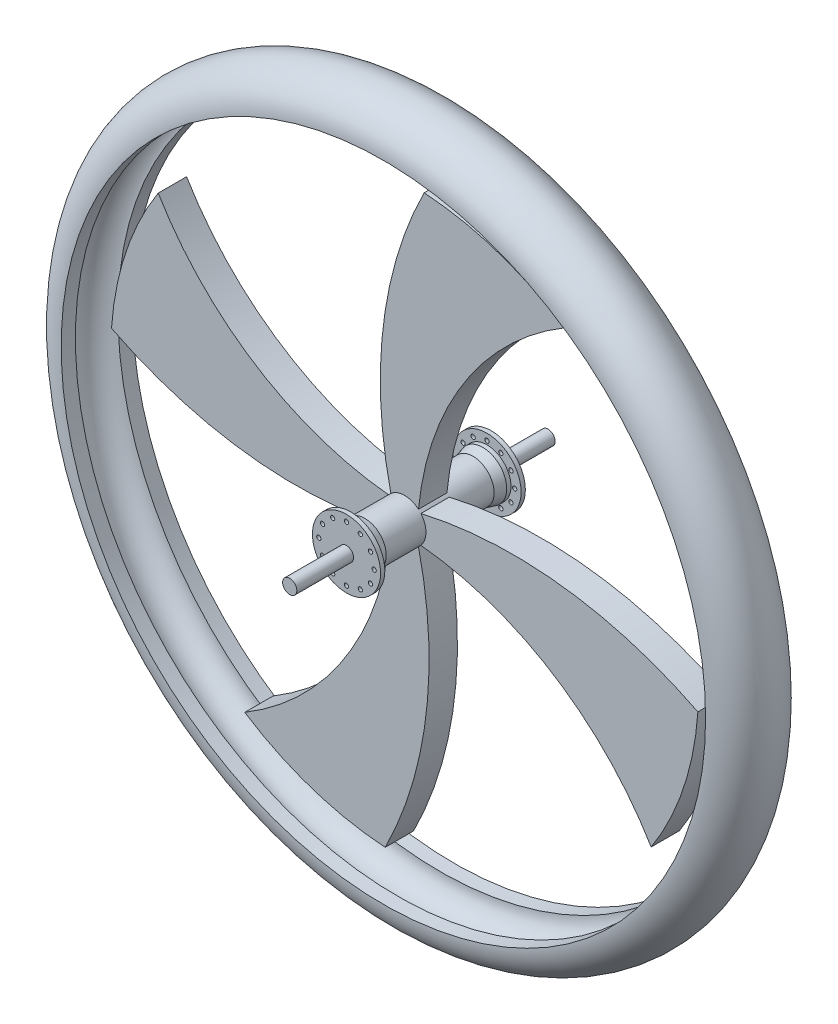
from build123d import *

# Parameters (mm, degrees)
SKETCH1_R           = 15
BOSS_EXTRUDE1_DEPTH = 38
SKETCH2_R           = 15
BOSS_EXTRUDE2_DEPTH = 7
BOSS_EXTRUDE2_DRAFT = -15
SKETCH3_R           = 16.875644347
BOSS_EXTRUDE3_DEPTH = 3
SKETCH4_R           = 24
BOSS_EXTRUDE4_DEPTH = 3
SKETCH5_R           = 1.5
CUT_EXTRUDE3_DEPTH  = 3
CIRPATTERN2_COUNT   = 12
SKETCH6_R           = 5
BOSS_EXTRUDE5_DEPTH = 40
BOSS_EXTRUDE7_DEPTH = 10


with BuildPart() as part:
    # Sketch1 → Boss-Extrude1 (new body)
    with BuildSketch(Plane.XY):
        Circle(SKETCH1_R)
    extrude(amount=BOSS_EXTRUDE1_DEPTH)


with BuildPart() as boss_extrude2_tool:
    # Sketch2 → Boss-Extrude2 (with draft: the straight prism first)
    with BuildSketch(Plane.XY.offset(38)):
        Circle(SKETCH2_R)
    extrude(amount=BOSS_EXTRUDE2_DEPTH)
    # Boss-Extrude2: the draft: its side faces are tilted about the plane it starts from
    boss_extrude2_sides = [boss_extrude2_tool.faces().sort_by_distance(p)[0] for p in [
        (-15, 0, 41.5),
    ]]
    draft(boss_extrude2_sides, Plane.XY.offset(38), BOSS_EXTRUDE2_DRAFT)


with BuildPart() as part_1:
    add(part.part)

    # Boss-Extrude2: add boss_extrude2_tool
    add(boss_extrude2_tool.part)

    # Sketch3 → Boss-Extrude3 (add)
    with BuildSketch(Plane.XY.offset(45)):
        Circle(SKETCH3_R)
    extrude(amount=BOSS_EXTRUDE3_DEPTH)

    # Sketch4 → Boss-Extrude4 (add)
    with BuildSketch(Plane.XY.offset(48)):
        Circle(SKETCH4_R)
    extrude(amount=BOSS_EXTRUDE4_DEPTH)

    # Sketch5 → Cut-Extrude3 (cut)
    with BuildSketch(Plane.XY.offset(51)):
        with Locations((0, 19.5)):
            Circle(SKETCH5_R)
    cut_extrude3 = extrude(amount=-CUT_EXTRUDE3_DEPTH, mode=Mode.SUBTRACT)

    # CirPattern2: Cut-Extrude3 ×12 about axis
    cirpattern2_axis = Axis((0, 0, 0), (0, 0, 1))
    for i in range(1, CIRPATTERN2_COUNT):
        add(cut_extrude3.rotate(cirpattern2_axis, i * 360 / CIRPATTERN2_COUNT), mode=Mode.SUBTRACT)

    # Mirror1: part across plane


with BuildPart() as part_2:
    add(part_1.part)
    add(part_1.part.mirror(Plane.XY))

    # Sketch6 → Boss-Extrude5 (add)
    with BuildSketch(Plane.XY.offset(51)):
        Circle(SKETCH6_R)
    extrude(amount=BOSS_EXTRUDE5_DEPTH)

    # Mirror2: part across plane


with BuildPart() as part_3:
    add(part_2.part)
    add(part_2.part.mirror(Plane.XY))

    # Sketch8 → Boss-Extrude7 (add, symmetric)
    with BuildSketch(Plane.XY):
        with BuildLine():
            ThreePointArc((13.734754013, 206.543836829), (65.30782189, 196.427819822), (112.671043027, 173.649751118))
            ThreePointArc((112.671043027, 173.649751118), (41.888763685, 104.790653332), (9.716380918, 11.427683136))
            ThreePointArc((9.716380918, 11.427683136), (0, 15), (-9.716380918, 11.427683136))
            ThreePointArc((-9.716380918, 11.427683136), (-15.120962757, 111.044643551), (13.734754013, 206.543836829))
        make_face()
        with BuildLine():
            ThreePointArc((11.427683136, 9.716380918), (111.044643551, 15.120962757), (206.543836829, -13.734754013))
            ThreePointArc((206.543836829, -13.734754013), (196.427819822, -65.30782189), (173.649751118, -112.671043027))
            ThreePointArc((173.649751118, -112.671043027), (104.790653332, -41.888763685), (11.427683136, -9.716380918))
            ThreePointArc((11.427683136, -9.716380918), (15, 0), (11.427683136, 9.716380918))
        make_face()
        with BuildLine():
            ThreePointArc((9.716380918, -11.427683136), (15.120962757, -111.044643551), (-13.734754013, -206.543836829))
            ThreePointArc((-13.734754013, -206.543836829), (-65.30782189, -196.427819822), (-112.671043027, -173.649751118))
            ThreePointArc((-112.671043027, -173.649751118), (-41.888763685, -104.790653332), (-9.716380918, -11.427683136))
            ThreePointArc((-9.716380918, -11.427683136), (0, -15), (9.716380918, -11.427683136))
        make_face()
        with BuildLine():
            ThreePointArc((-11.427683136, -9.716380918), (-111.044643551, -15.120962757), (-206.543836829, 13.734754013))
            ThreePointArc((-206.543836829, 13.734754013), (-196.427819822, 65.30782189), (-173.649751118, 112.671043027))
            ThreePointArc((-173.649751118, 112.671043027), (-104.790653332, 41.888763685), (-11.427683136, 9.716380918))
            ThreePointArc((-11.427683136, 9.716380918), (-15, 0), (-11.427683136, -9.716380918))
        make_face()
    extrude(amount=BOSS_EXTRUDE7_DEPTH, both=True)


with BuildPart() as body_2:
    # Sketch9 → Revolve-Thin1 (revolve)
    with BuildSketch(Plane(origin=(0, 0, 0), x_dir=(1, 0, 0), z_dir=(0, 1, 0))):
        with BuildLine():
            ThreePointArc((227, 25), (252, 0), (227, -25))
            Line((227, -25), (227, -15))
            ThreePointArc((227, -15), (242, 0), (227, 15))
            Line((227, 15), (227, 25))
        make_face()
    revolve(axis=Axis((0, 0, 38), (0, 0, -1)))


solid = Compound([part_3.part, body_2.part])
